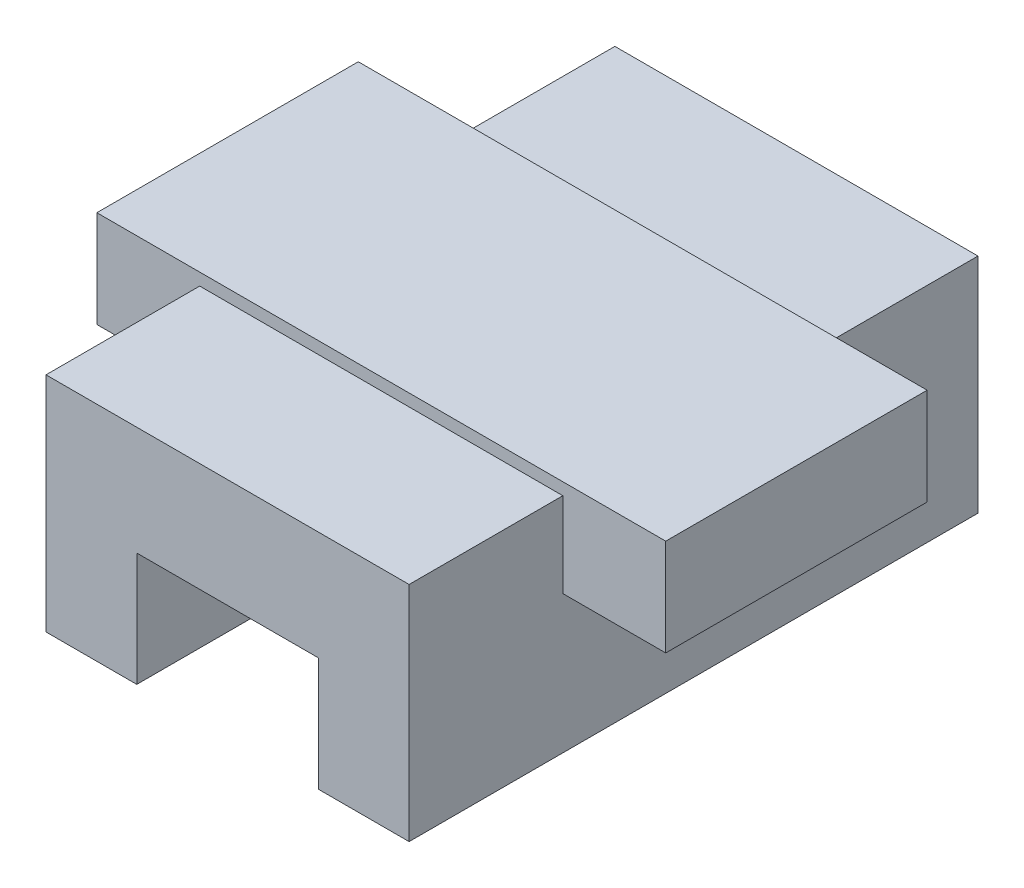
from build123d import *

# Parameters (mm, degrees)
BOSS_EXTRUDE1_DEPTH = 23.5
BOSS_EXTRUDE2_DEPTH = 10.8


with BuildPart() as part:
    # Sketch1 → Boss-Extrude1 (new, symmetric)
    with BuildSketch(Plane.XY):
        Polygon((7.5, 7), (7.5, -2.4), (15, -2.4), (15, 16), (-15, 16), (-15, -2.4), (-7.5, -2.4), (-7.5, 7), align=None)
    extrude(amount=BOSS_EXTRUDE1_DEPTH, both=True)

    # Sketch1<3> → Boss-Extrude2 (add, symmetric)
    with BuildSketch(Plane.XY):
        Polygon((15, 16), (15, 9), (23.5, 9), (23.5, 17), (-23.5, 17), (-23.5, 9), (-15, 9), (-15, 16), align=None)
    extrude(amount=BOSS_EXTRUDE2_DEPTH, both=True)


solid = part.part
